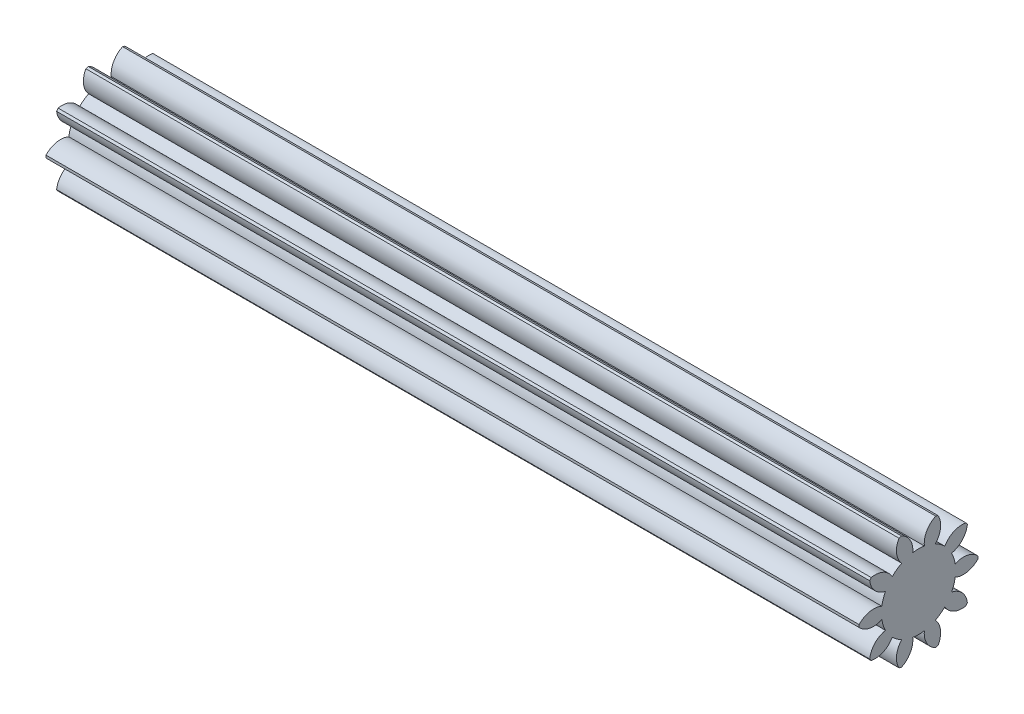
from build123d import *

# Parameters (mm, degrees)
BASPROSKE_W     = 164.092427176
BASPROSKE_H     = 12
TOOTHCUT_DEPTH  = 165.967647302
TEETHCUTS_COUNT = 10
TEETHCUTS_ANGLE = 324
BORSKE_R        = 0.4
BORE_DEPTH      = 50.0000508
SCALE1_SCALE    = 0.399751684


with BuildPart() as part:
    # BasProSke → Base-Revolve (revolve)
    with BuildSketch(Plane(origin=(0, 0, 0), x_dir=(1, 0, 0), z_dir=(0, 1, 0)), mode=Mode.PRIVATE) as base_revolve_sk:
        with Locations((82.046213588, 6)):
            Rectangle(BASPROSKE_W, BASPROSKE_H)
    revolve(base_revolve_sk.sketch.rotate(Axis((-10, 0, 0), (1, 0, 0)), 180), axis=Axis((-10, 0, 0), (1, 0, 0)))

    # TooCutSke → ToothCut (cut, through all)
    with BuildSketch(Plane(origin=(0, 0, 0), x_dir=(0, 0, -1), z_dir=(1, 0, 0))):
        with BuildLine():
            ThreePointArc((1.173662691, 7.406586048), (0, 7.499), (-1.173662691, 7.406586048))
            ThreePointArc((-1.173662691, 7.406586048), (-1.668191438, 9.834565786), (-3.497907776, 11.50542856))
            ThreePointArc((-3.497907776, 11.50542856), (0, 12.0254), (3.497907776, 11.50542856))
            ThreePointArc((3.497907776, 11.50542856), (1.668191438, 9.834565786), (1.173662691, 7.406586048))
        make_face()
    toothcut = extrude(amount=TOOTHCUT_DEPTH, mode=Mode.SUBTRACT)

    # TeethCuts: ToothCut ×10 about axis
    teethcuts_axis = Axis((-10, 0, 0), (1, 0, 0))
    for i in range(1, TEETHCUTS_COUNT):
        add(toothcut.rotate(teethcuts_axis, i * TEETHCUTS_ANGLE / (TEETHCUTS_COUNT - 1)), mode=Mode.SUBTRACT)

    # BorSke → Bore (cut, symmetric)
    with BuildSketch(Plane(origin=(0, 0, 0), x_dir=(0, 0, -1), z_dir=(1, 0, 0))):
        Circle(BORSKE_R)
    extrude(amount=BORE_DEPTH, both=True, mode=Mode.SUBTRACT)


with BuildPart() as part_1:
    # Scale1: scaled about (82.076460717, 0, 0)
    add(part.part.scale(SCALE1_SCALE).moved(Location((49.266257357, 0, 0))))


solid = part_1.part
